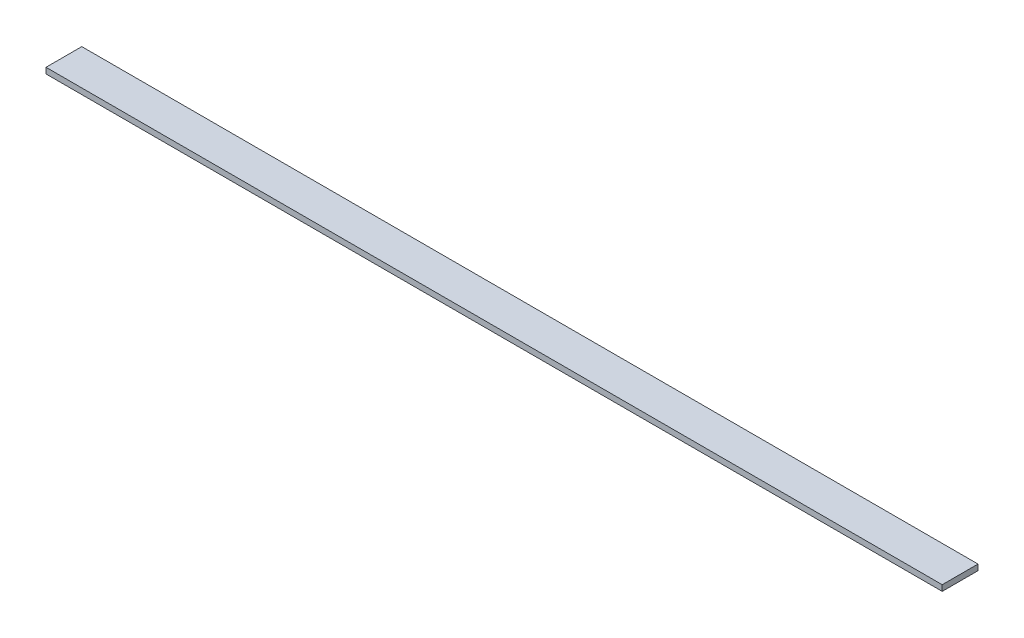
from build123d import *

# Parameters (mm, degrees)
SKETCH3_W           = 5883.275
SKETCH3_H           = 234.95
BOSS_EXTRUDE1_DEPTH = 38.1


with BuildPart() as part:
    # Sketch3 → Boss-Extrude1 (new body)
    with BuildSketch(Plane(origin=(0, 0, 0), x_dir=(1, 0, 0), z_dir=(0, 1, 0))):
        with Locations((-869.773611111, 1546.754166667)):
            Rectangle(SKETCH3_W, SKETCH3_H)
    extrude(amount=BOSS_EXTRUDE1_DEPTH)


solid = part.part
